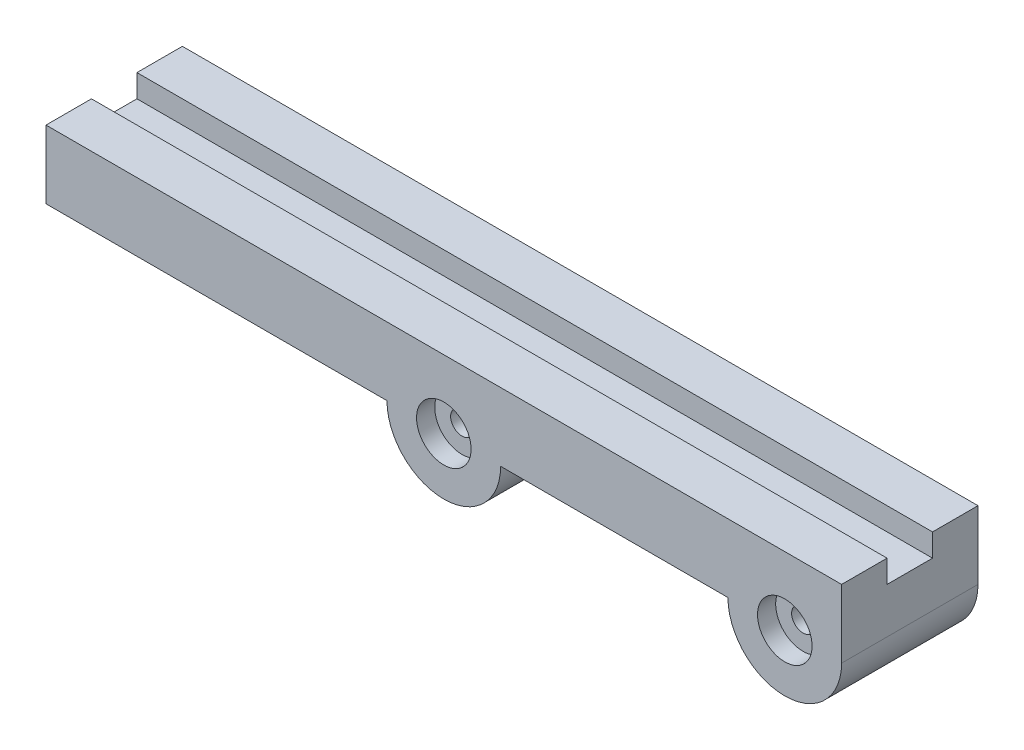
from build123d import *

# Parameters (mm, degrees)
BOSS_EXTRUDE1_DEPTH = 30
CUT_EXTRUDE2_REACH  = 180.185
SKETCH2_R           = 2.5
SKETCH2_3_R         = 6
SKETCH2_3_R_2       = 2.5
CUT_EXTRUDE3_DEPTH  = 4
SKETCH3_W           = 175
SKETCH3_H           = 10
CUT_EXTRUDE4_DEPTH  = 5


with BuildPart() as part:
    # Sketch1 → Boss-Extrude1 (new body)
    with BuildSketch(Plane.XY):
        with BuildLine():
            Line((0, 0), (75, 0))
            ThreePointArc((75, 0), (87.5, -12.5), (100, 0))
            Line((100, 0), (150, 0))
            ThreePointArc((150, 0), (162.5, -12.5), (175, 0))
            Line((175, 0), (175, 15))
            Line((175, 15), (0, 15))
            Line((0, 15), (0, 0))
        make_face()
    extrude(amount=BOSS_EXTRUDE1_DEPTH)

    # Sketch2 → Cut-Extrude2 (cut, up to next)
    with BuildSketch(Plane.XY.offset(30), mode=Mode.PRIVATE) as cut_extrude2_sk1:
        with Locations((87.5, 0)):
            Circle(SKETCH2_R)
    cut_extrude2_tool1 = extrude(cut_extrude2_sk1.sketch, amount=-CUT_EXTRUDE2_REACH, mode=Mode.PRIVATE) & part.part
    # Sketch2 → Cut-Extrude2 (cut, up to next)
    with BuildSketch(Plane.XY.offset(30), mode=Mode.PRIVATE) as cut_extrude2_sk2:
        with Locations((162.5, 0)):
            Circle(SKETCH2_R)
    cut_extrude2_tool2 = extrude(cut_extrude2_sk2.sketch, amount=-CUT_EXTRUDE2_REACH, mode=Mode.PRIVATE) & part.part
    add(cut_extrude2_tool1.solids().sort_by_distance((87.5, 0, 30))[0], mode=Mode.SUBTRACT)
    add(cut_extrude2_tool2.solids().sort_by_distance((162.5, 0, 30))[0], mode=Mode.SUBTRACT)

    # Sketch2<3> → Cut-Extrude3 (cut)
    # profile 1 of 2: a face of its own
    with BuildSketch(Plane.XY.offset(30)):
        with Locations((87.5, 0)):
            Circle(SKETCH2_3_R)
        with Locations((87.5, 0)):
            Circle(SKETCH2_3_R_2, mode=Mode.SUBTRACT)
    # profile 2 of 2: a face of its own
    with BuildSketch(Plane.XY.offset(30)):
        with Locations((162.5, 0)):
            Circle(SKETCH2_3_R)
        with Locations((162.5, 0)):
            Circle(SKETCH2_3_R_2, mode=Mode.SUBTRACT)
    extrude(amount=-CUT_EXTRUDE3_DEPTH, mode=Mode.SUBTRACT)

    # Sketch3 → Cut-Extrude4 (cut)
    with BuildSketch(Plane(origin=(0, 15, 0), x_dir=(1, 0, 0), z_dir=(0, 1, 0))):
        with Locations((87.5, -15)):
            Rectangle(SKETCH3_W, SKETCH3_H)
    extrude(amount=-CUT_EXTRUDE4_DEPTH, mode=Mode.SUBTRACT)


solid = part.part
